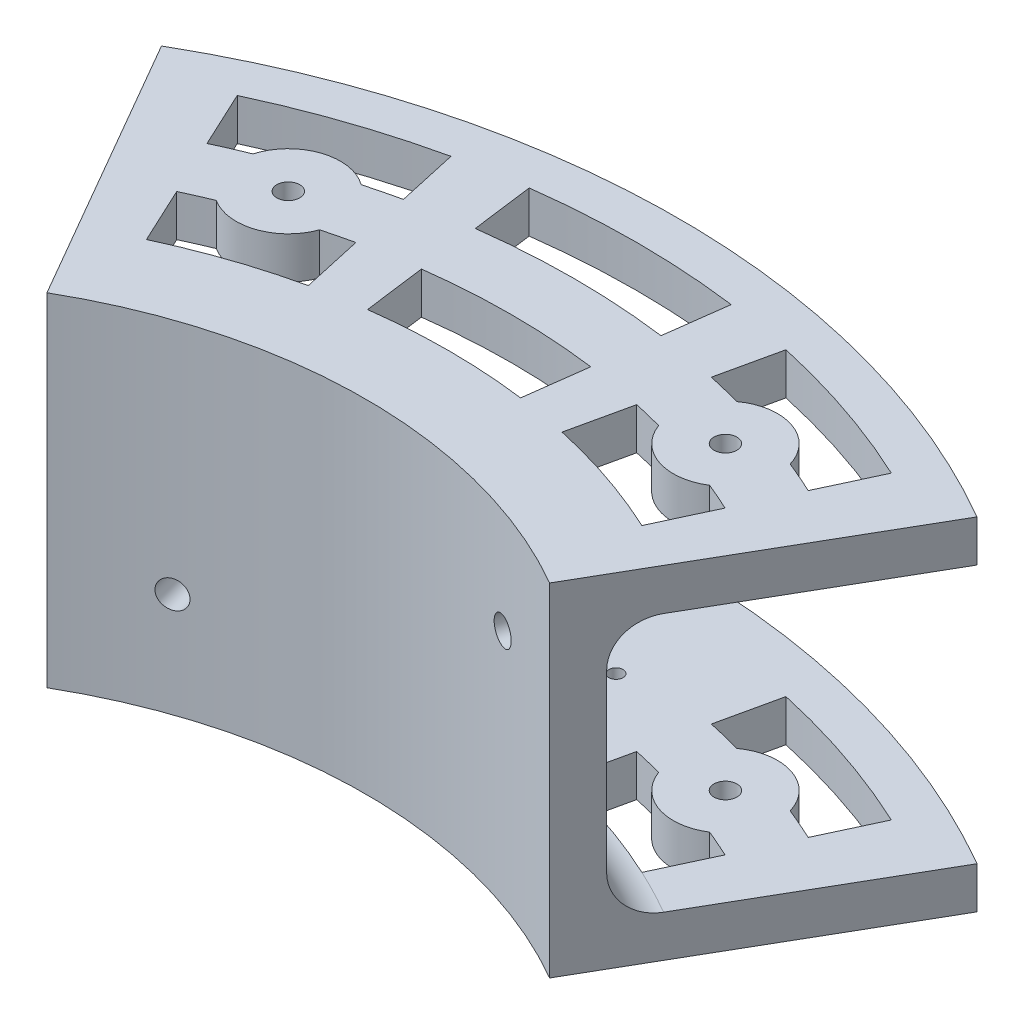
from build123d import *

# Parameters (mm, degrees)
SALIENTE_EXTRUIR1_DEPTH                = 10
CROQUIS5_W                             = 37
CROQUIS5_H                             = 22.5
CORTAR_EXTRUIR1_DEPTH                  = 5
TALADRO_DE_MARGEN_PARA_M31_D           = 3.4
TALADRO_DE_MARGEN_PARA_M31_CSINK_D     = 3.45
TALADRO_DE_MARGEN_PARA_M31_CSINK_ANGLE = 90
SALIENTE_EXTRUIR2_DEPTH                = 62
SALIENTE_EXTRUIR3_DEPTH                = 10
REDONDEO2_R                            = 10
CORTAR_EXTRUIR2_DEPTH                  = 10
CORTAR_EXTRUIR3_START                  = -10
CORTAR_EXTRUIR3_DEPTH                  = 10
TALADRO_DE_MARGEN_PARA_M61_D           = 6.6
TALADRO_DE_MARGEN_PARA_M61_CSINK_D     = 6.65
TALADRO_DE_MARGEN_PARA_M61_CSINK_ANGLE = 90
TALADRO_DE_MARGEN_PARA_M62_D           = 6.6
TALADRO_DE_MARGEN_PARA_M62_CSINK_D     = 6.65
TALADRO_DE_MARGEN_PARA_M62_CSINK_ANGLE = 90
CROQUIS25_R                            = 12.5
SALIENTE_EXTRUIR4_DEPTH                = 10
SALIENTE_EXTRUIR5_START                = -10
CROQUIS26_R                            = 12.5
SALIENTE_EXTRUIR5_DEPTH                = 10
TALADRO_DE_MARGEN_PARA_M51_D           = 5.5
SALIENTE_EXTRUIR6_DEPTH                = 10
REDONDEO3_R                            = 1


with BuildPart() as part:
    # Croquis1 → Saliente-Extruir1 (new body)
    with BuildSketch(Plane(origin=(0, 0, 0), x_dir=(1, 0, 0), z_dir=(0, 1, 0))):
        with BuildLine():
            Line((-97.75, 169.30796644), (-60.25, 104.356061156))
            ThreePointArc((-60.25, 104.356061156), (0, 120.5), (60.25, 104.356061156))
            Line((60.25, 104.356061156), (97.75, 169.30796644))
            ThreePointArc((97.75, 169.30796644), (0, 195.5), (-97.75, 169.30796644))
        make_face()
    extrude(amount=SALIENTE_EXTRUIR1_DEPTH)

    # Croquis5 → Cortar-Extruir1 (cut)
    with BuildSketch(Plane.XZ):
        with Locations((0, -158)):
            Rectangle(CROQUIS5_W, CROQUIS5_H)
    extrude(amount=-CORTAR_EXTRUIR1_DEPTH, mode=Mode.SUBTRACT)

    # Taladro de margen para M31 (through all)
    with Locations(Plane(origin=(0, 5, 0), x_dir=(-1, 0, 0), z_dir=(0, -1, 0))):
        with Locations((-15, 165.5), (-15, 150.5), (15, 150.5), (15, 165.5)):
            CounterSinkHole(TALADRO_DE_MARGEN_PARA_M31_D / 2, TALADRO_DE_MARGEN_PARA_M31_CSINK_D / 2, counter_sink_angle=TALADRO_DE_MARGEN_PARA_M31_CSINK_ANGLE)

    # Croquis14 → Saliente-Extruir2 (add)
    with BuildSketch(Plane(origin=(0, 10, 0), x_dir=(1, 0, 0), z_dir=(0, 1, 0))):
        with BuildLine():
            Line((-65.25, 113.016315194), (-60.25, 104.356061156))
            ThreePointArc((-60.25, 104.356061156), (0, 120.5), (60.25, 104.356061156))
            Line((60.25, 104.356061156), (65.25, 113.016315194))
            ThreePointArc((65.25, 113.016315194), (0, 130.5), (-65.25, 113.016315194))
        make_face()
    extrude(amount=SALIENTE_EXTRUIR2_DEPTH)

    # Croquis15 → Saliente-Extruir3 (add)
    with BuildSketch(Plane(origin=(0, 72, 0), x_dir=(1, 0, 0), z_dir=(0, 1, 0))):
        with BuildLine():
            Line((-97.75, 169.30796644), (-60.25, 104.356061156))
            ThreePointArc((-60.25, 104.356061156), (0, 120.5), (60.25, 104.356061156))
            Line((60.25, 104.356061156), (97.75, 169.30796644))
            ThreePointArc((97.75, 169.30796644), (0, 195.5), (-97.75, 169.30796644))
        make_face()
    extrude(amount=SALIENTE_EXTRUIR3_DEPTH)

    # Redondeo2
    redondeo2_edges = [part.edges().sort_by_distance(p)[0] for p in [
        (0, 10, -130.5),
        (0, 72, -130.5),
    ]]
    fillet(redondeo2_edges, radius=REDONDEO2_R)

    # Croquis16 → Cortar-Extruir2 (cut)
    with BuildSketch(Plane(origin=(0, 82, 0), x_dir=(1, 0, 0), z_dir=(0, 1, 0))):
        with BuildLine():
            Line((-78.395687553, 168.120094495), (-72.056413627, 154.52547769))
            ThreePointArc((-72.056413627, 154.52547769), (-54.805428834, 161.451587079), (-36.902954176, 166.458469214))
            Line((-36.902954176, 166.458469214), (-40.149548386, 181.102909321))
            ThreePointArc((-40.149548386, 181.102909321), (-59.627020814, 175.655539021), (-78.395687553, 168.120094495))
        make_face()
        with BuildLine():
            Line((-65.717139701, 140.930860884), (-59.377865775, 127.336244079))
            ThreePointArc((-59.377865775, 127.336244079), (-45.162244875, 133.043683194), (-30.409765758, 137.169589))
            Line((-30.409765758, 137.169589), (-33.656359967, 151.814029107))
            ThreePointArc((-33.656359967, 151.814029107), (-49.983836855, 147.247635136), (-65.717139701, 140.930860884))
        make_face()
        with BuildLine():
            Line((-24.212608657, 183.913021785), (-22.254715774, 169.041348864))
            ThreePointArc((-22.254715774, 169.041348864), (0, 170.5), (22.254715774, 169.041348864))
            Line((22.254715774, 169.041348864), (24.212608657, 183.913021785))
            ThreePointArc((24.212608657, 183.913021785), (0, 185.5), (-24.212608657, 183.913021785))
        make_face()
        with BuildLine():
            Line((-20.29682289, 154.169675944), (-18.338930007, 139.298003023))
            ThreePointArc((-18.338930007, 139.298003023), (0, 140.5), (18.338930007, 139.298003023))
            Line((18.338930007, 139.298003023), (20.29682289, 154.169675944))
            ThreePointArc((20.29682289, 154.169675944), (0, 155.5), (-20.29682289, 154.169675944))
        make_face()
        with BuildLine():
            Line((40.149548386, 181.102909321), (36.902954176, 166.458469214))
            ThreePointArc((36.902954176, 166.458469214), (54.805428834, 161.451587079), (72.056413627, 154.52547769))
            Line((72.056413627, 154.52547769), (78.395687553, 168.120094495))
            ThreePointArc((78.395687553, 168.120094495), (59.627020814, 175.655539021), (40.149548386, 181.102909321))
        make_face()
        with BuildLine():
            Line((33.656359967, 151.814029107), (30.409765758, 137.169589))
            ThreePointArc((30.409765758, 137.169589), (45.162244875, 133.043683194), (59.377865775, 127.336244079))
            Line((59.377865775, 127.336244079), (65.717139701, 140.930860884))
            ThreePointArc((65.717139701, 140.930860884), (49.983836855, 147.247635136), (33.656359967, 151.814029107))
        make_face()
    extrude(amount=-CORTAR_EXTRUIR2_DEPTH, mode=Mode.SUBTRACT)

    # Croquis19 → Cortar-Extruir3 (cut)
    with BuildSketch(Plane.XZ.offset(CORTAR_EXTRUIR3_START)):
        with BuildLine():
            Line((72.056413627, -154.52547769), (78.395687553, -168.120094495))
            ThreePointArc((78.395687553, -168.120094495), (59.627020814, -175.655539021), (40.149548386, -181.102909321))
            Line((40.149548386, -181.102909321), (36.902954176, -166.458469214))
            ThreePointArc((36.902954176, -166.458469214), (54.805428834, -161.451587079), (72.056413627, -154.52547769))
        make_face()
        with BuildLine():
            Line((59.377865775, -127.336244079), (65.717139701, -140.930860884))
            ThreePointArc((65.717139701, -140.930860884), (49.983836855, -147.247635136), (33.656359967, -151.814029107))
            Line((33.656359967, -151.814029107), (30.409765758, -137.169589))
            ThreePointArc((30.409765758, -137.169589), (45.162244875, -133.043683194), (59.377865775, -127.336244079))
        make_face()
        with BuildLine():
            Line((-78.395687553, -168.120094495), (-72.056413627, -154.52547769))
            ThreePointArc((-72.056413627, -154.52547769), (-54.805428834, -161.451587079), (-36.902954176, -166.458469214))
            Line((-36.902954176, -166.458469214), (-40.149548386, -181.102909321))
            ThreePointArc((-40.149548386, -181.102909321), (-59.627020814, -175.655539021), (-78.395687553, -168.120094495))
        make_face()
        with BuildLine():
            Line((-65.717139701, -140.930860884), (-59.377865775, -127.336244079))
            ThreePointArc((-59.377865775, -127.336244079), (-45.162244875, -133.043683194), (-30.409765758, -137.169589))
            Line((-30.409765758, -137.169589), (-33.656359967, -151.814029107))
            ThreePointArc((-33.656359967, -151.814029107), (-49.983836855, -147.247635136), (-65.717139701, -140.930860884))
        make_face()
    extrude(amount=CORTAR_EXTRUIR3_DEPTH, mode=Mode.SUBTRACT)

    # Taladro de margen para M61 (through all)
    with Locations(Plane(origin=(33.775885386, 0, -126.053320331), x_dir=(0, -1, 0), z_dir=(0.2588190451025245, 0, -0.9659258262890673))):
        with Locations((-57, -8.775885386)):
            CounterSinkHole(TALADRO_DE_MARGEN_PARA_M61_D / 2, TALADRO_DE_MARGEN_PARA_M61_CSINK_D / 2, counter_sink_angle=TALADRO_DE_MARGEN_PARA_M61_CSINK_ANGLE)

    # Taladro de margen para M62 (through all)
    with Locations(Plane(origin=(-33.775885386, 0, -126.053320331), x_dir=(0, -1, 0), z_dir=(-0.25881904510252496, 0, -0.9659258262890672))):
        with Locations((-25, 8.775885386)):
            CounterSinkHole(TALADRO_DE_MARGEN_PARA_M62_D / 2, TALADRO_DE_MARGEN_PARA_M62_CSINK_D / 2, counter_sink_angle=TALADRO_DE_MARGEN_PARA_M62_CSINK_ANGLE)

    # Croquis25 → Saliente-Extruir4 (add)
    with BuildSketch(Plane(origin=(0, 82, 0), x_dir=(1, 0, 0), z_dir=(0, 1, 0))):
        with Locations((-52.394632844, 154.349611108)):
            Circle(CROQUIS25_R)
        with Locations((52.394632844, 154.349611108)):
            Circle(CROQUIS25_R)
    extrude(amount=-SALIENTE_EXTRUIR4_DEPTH)

    # Croquis26 → Saliente-Extruir5 (add)
    with BuildSketch(Plane.XZ.offset(SALIENTE_EXTRUIR5_START)):
        with Locations((-52.394632844, -154.349611108)):
            Circle(CROQUIS26_R)
        with Locations((52.394632844, -154.349611108)):
            Circle(CROQUIS26_R)
    extrude(amount=SALIENTE_EXTRUIR5_DEPTH)

    # Taladro de margen para M51 (through all)
    with Locations(Plane(origin=(0, 82, 0), x_dir=(1, 0, 0), z_dir=(0, 1, 0))):
        with Locations((-52.394632844, 154.349611108), (52.394632844, 154.349611108)):
            Hole(TALADRO_DE_MARGEN_PARA_M51_D / 2)

    # Croquis29 → Saliente-Extruir6 (add)
    with BuildSketch(Plane.XZ):
        with BuildLine():
            Line((-87.310760741, -181.520781065), (-89.757791766, -182.661850371))
            ThreePointArc((-89.757791766, -182.661850371), (-82.267824184, -174.487985076), (-81.784235474, -185.563987523))
            Line((-81.784235474, -185.563987523), (-82.92530478, -183.116956498))
            ThreePointArc((-82.92530478, -183.116956498), (-83.191278571, -177.025155152), (-87.310760741, -181.520781065))
        make_face()
    extrude(amount=-SALIENTE_EXTRUIR6_DEPTH)

    # Redondeo3
    redondeo3_edges = [part.edges().sort_by_distance(p)[0] for p in [
        (-89.757791766, 5, -182.661850371),
        (-81.784235474, 5, -185.563987523),
        (-82.92530478, 5, -183.116956498),
        (-87.310760741, 5, -181.520781065),
    ]]
    fillet(redondeo3_edges, radius=REDONDEO3_R)


solid = part.part
